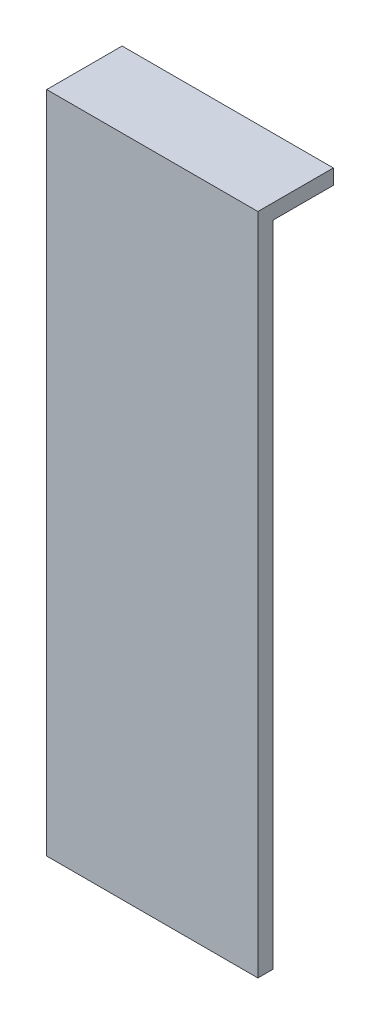
from build123d import *

# Parameters (mm, degrees)
SKETCH3_W           = 70
SKETCH3_H           = 220
BOSS_EXTRUDE2_DEPTH = 5
SKETCH4_W           = 5
SKETCH4_H           = 100
BOSS_EXTRUDE3_DEPTH = 10
SKETCH5_W           = 70
SKETCH5_H           = 5
BOSS_EXTRUDE4_DEPTH = 20


with BuildPart() as part:
    # Sketch3 → Boss-Extrude2 (new body)
    with BuildSketch(Plane.XY):
        with Locations((-67.431106164, 0)):
            Rectangle(SKETCH3_W, SKETCH3_H)
    extrude(amount=BOSS_EXTRUDE2_DEPTH)

    # Sketch4 → Boss-Extrude3 (add)
    with BuildSketch(Plane.XY):
        with Locations((-99.931106164, -60)):
            Rectangle(SKETCH4_W, SKETCH4_H)
    extrude(amount=-BOSS_EXTRUDE3_DEPTH)

    # Sketch5 → Boss-Extrude4 (add)
    with BuildSketch(Plane.XY):
        with Locations((-67.431106164, 107.5)):
            Rectangle(SKETCH5_W, SKETCH5_H)
    extrude(amount=-BOSS_EXTRUDE4_DEPTH)


solid = part.part
